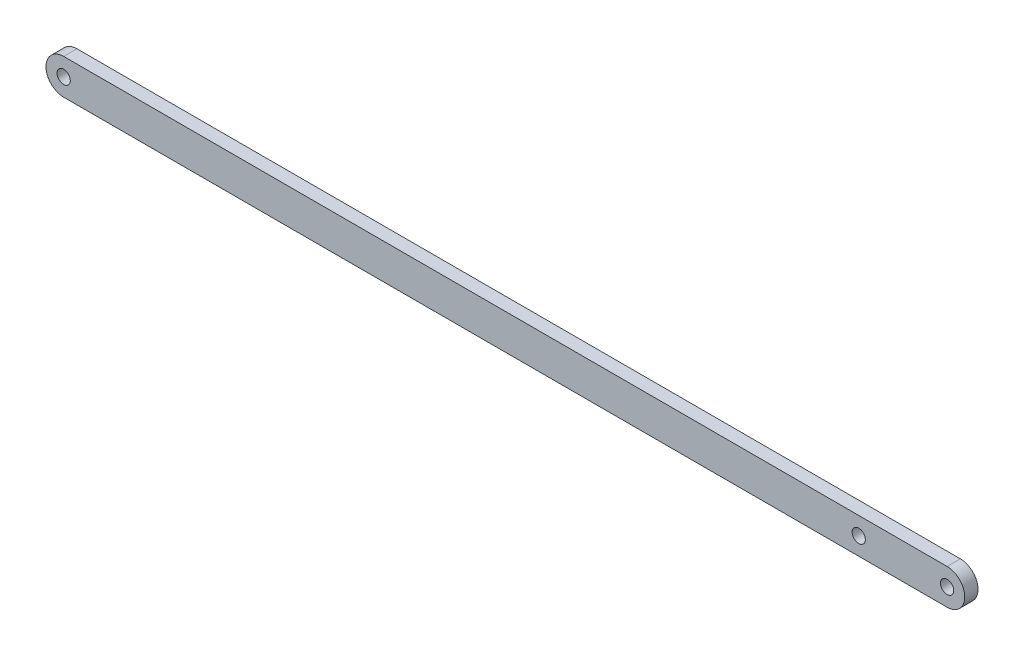
from build123d import *

# Parameters (mm, degrees)
SKETCH1_R           = 3
BOSS_EXTRUDE1_DEPTH = 6
SCALE1_SCALE        = 0.5


with BuildPart() as part:
    # Sketch1 → Boss-Extrude1 (new body)
    with BuildSketch(Plane.XY):
        with BuildLine():
            Line((-200, 8), (200, 8))
            ThreePointArc((200, 8), (208, 0), (200, -8))
            Line((200, -8), (-200, -8))
            ThreePointArc((-200, -8), (-208, 0), (-200, 8))
        make_face()
        with Locations((-200, 0)):
            Circle(SKETCH1_R, mode=Mode.SUBTRACT)
        with Locations((200, 0)):
            Circle(SKETCH1_R, mode=Mode.SUBTRACT)
        with Locations((160, 0)):
            Circle(SKETCH1_R, mode=Mode.SUBTRACT)
    extrude(amount=-BOSS_EXTRUDE1_DEPTH)


with BuildPart() as part_1:
    # Scale1: scaled about (-0.694249163, 0, -3)
    add(part.part.scale(SCALE1_SCALE).moved(Location((-0.347124581, 0, -1.5))))


solid = part_1.part
